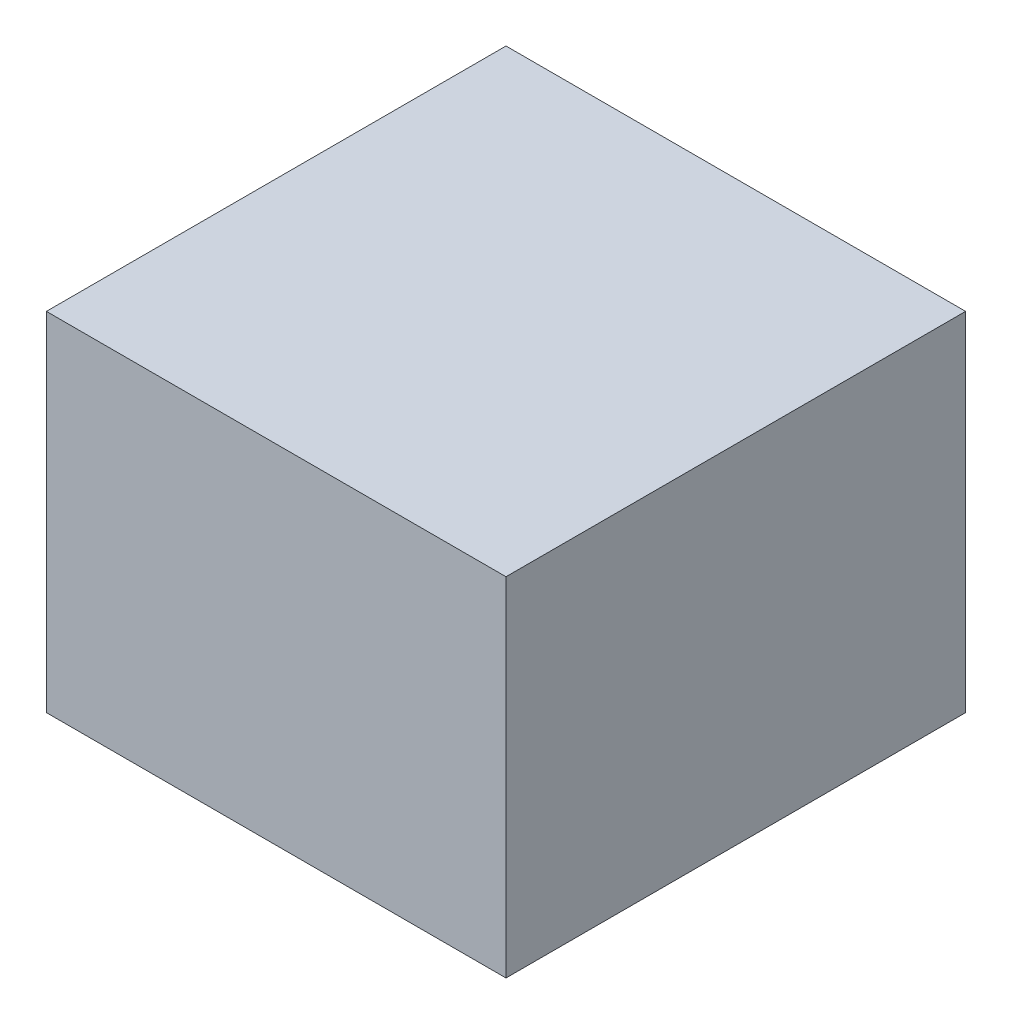
from build123d import *

# Parameters (mm, degrees)
SKETCH_1_W      = 82
SKETCH_1_H      = 82
EXTRUDE_1_DEPTH = 62


with BuildPart() as part:
    # 스케치1 → 보스-돌출1 (new body)
    with BuildSketch(Plane(origin=(0, 0, 0), x_dir=(1, 0, 0), z_dir=(0, 1, 0))):
        Rectangle(SKETCH_1_W, SKETCH_1_H)
    extrude(amount=EXTRUDE_1_DEPTH)


solid = part.part
